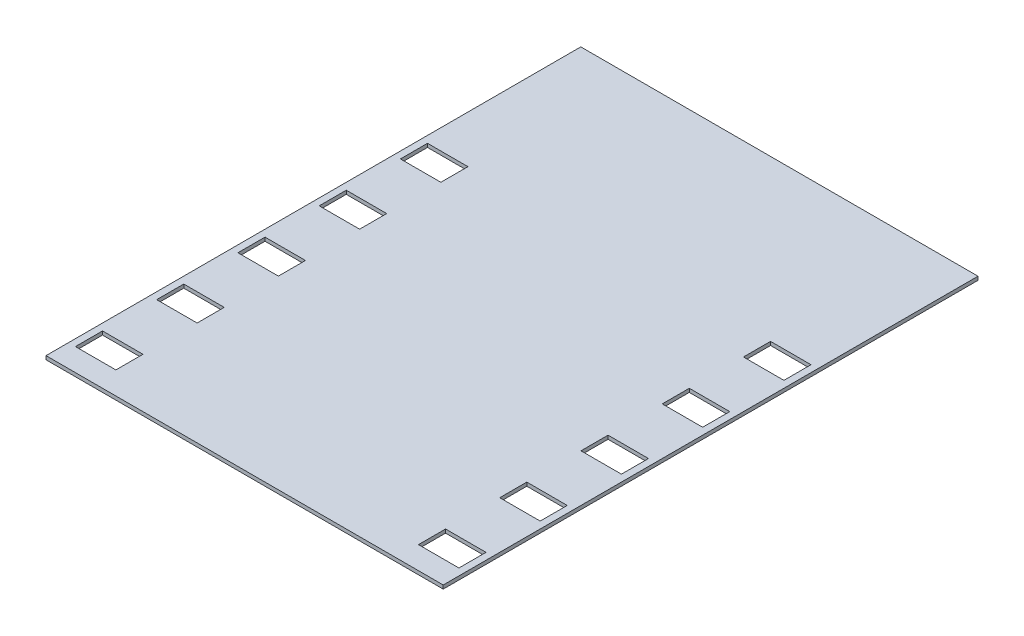
from build123d import *

# Parameters (mm, degrees)
SKETCH1_W           = 279.4
SKETCH1_H           = 376.174
BOSS_EXTRUDE1_DEPTH = 2.54
SKETCH2_W           = 28.448
SKETCH2_H           = 19.05
CUT_EXTRUDE1_DEPTH  = 235.305913645


with BuildPart() as part:
    # Sketch1 → Boss-Extrude1 (new body)
    with BuildSketch(Plane(origin=(0, 0, 0), x_dir=(1, 0, 0), z_dir=(0, 1, 0))):
        Rectangle(SKETCH1_W, SKETCH1_H)
    extrude(amount=BOSS_EXTRUDE1_DEPTH)

    # Sketch2 → Cut-Extrude1 (cut, through all)
    with BuildSketch(Plane(origin=(0, 2.54, 0), x_dir=(1, 0, 0), z_dir=(0, 1, 0))):
        with Locations((-120.65, -105.537)):
            Rectangle(SKETCH2_W, SKETCH2_H)
        with Locations((-120.65, -162.687)):
            Rectangle(SKETCH2_W, SKETCH2_H)
        with Locations((-120.65, -48.387)):
            Rectangle(SKETCH2_W, SKETCH2_H)
        with Locations((-120.65, 8.763)):
            Rectangle(SKETCH2_W, SKETCH2_H)
        with Locations((-120.65, 65.913)):
            Rectangle(SKETCH2_W, SKETCH2_H)
        with Locations((120.65, 65.913)):
            Rectangle(SKETCH2_W, SKETCH2_H)
        with Locations((120.65, 8.763)):
            Rectangle(SKETCH2_W, SKETCH2_H)
        with Locations((120.65, -48.387)):
            Rectangle(SKETCH2_W, SKETCH2_H)
        with Locations((120.65, -105.537)):
            Rectangle(SKETCH2_W, SKETCH2_H)
        with Locations((120.65, -162.687)):
            Rectangle(SKETCH2_W, SKETCH2_H)
    extrude(amount=-CUT_EXTRUDE1_DEPTH, mode=Mode.SUBTRACT)


solid = part.part
